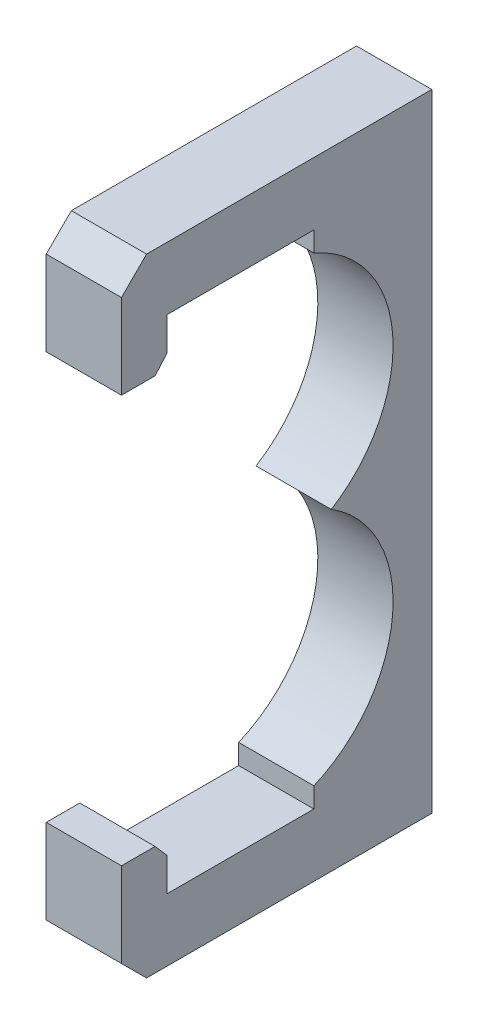
from build123d import *

# Parameters (mm, degrees)
BOSS_EXTRUDE1_DEPTH = 6
SKETCH4_R           = 1.25
CUT_EXTRUDE1_DEPTH  = 6


with BuildPart() as part:
    # Sketch1 → Boss-Extrude1 (new body)
    with BuildSketch(Plane(origin=(0, 0, 0), x_dir=(0, 0, -1), z_dir=(1, 0, 0))):
        with BuildLine():
            Line((41.203205101, 15.688911622), (43.203205101, 17.688911622))
            Line((43.203205101, 17.688911622), (65.948748697, 17.688911622))
            Line((65.948748697, 17.688911622), (65.948748697, -32.311088378))
            Line((65.948748697, -32.311088378), (43.203205101, -32.311088378))
            Line((43.203205101, -32.311088378), (41.203205101, -30.311088378))
            Line((41.203205101, -30.311088378), (41.203205101, -23.561088378))
            Line((41.203205101, -23.561088378), (43.880106331, -23.561088378))
            Line((43.880106331, -23.561088378), (44.81485523, -24.633587377))
            Line((44.81485523, -24.633587377), (44.81485523, -27.311088378))
            Line((44.81485523, -27.311088378), (56.547992273, -27.311088378))
            Line((56.547992273, -27.311088378), (56.547992273, -25.708962028))
            ThreePointArc((56.547992273, -25.708962028), (62.834374894, -16.931491254), (57.934329164, -7.311088378))
            ThreePointArc((57.934329164, -7.311088378), (62.834374894, 2.309314498), (56.547992273, 11.086785272))
            Line((56.547992273, 11.086785272), (56.547992273, 12.688911622))
            Line((56.547992273, 12.688911622), (44.81485523, 12.688911622))
            Line((44.81485523, 12.688911622), (44.81485523, 10.011410621))
            Line((44.81485523, 10.011410621), (43.880106331, 8.938911622))
            Line((43.880106331, 8.938911622), (41.203205101, 8.938911622))
            Line((41.203205101, 8.938911622), (41.203205101, 15.688911622))
        make_face()
    extrude(amount=BOSS_EXTRUDE1_DEPTH)

    # Sketch4 → Cut-Extrude1 (cut)
    with BuildSketch(Plane(origin=(0, 0, -65.948748697), x_dir=(-1, 0, 0), z_dir=(0, 0, -1))):
        with Locations((-3, 15.188911622)):
            Circle(SKETCH4_R)
        with Locations(Location((-3, -29.622535768, 0), (0, 0, 180))):
            Circle(SKETCH4_R)
    extrude(amount=-CUT_EXTRUDE1_DEPTH, mode=Mode.SUBTRACT)


solid = part.part
